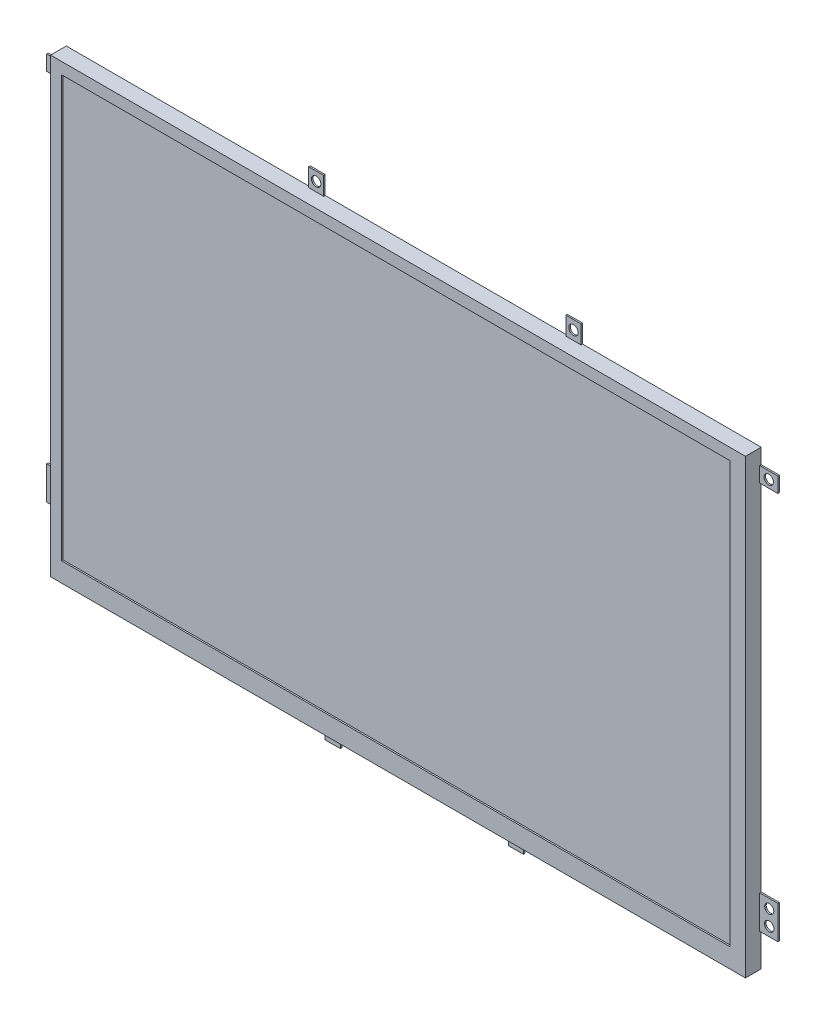
from build123d import *

# Parameters (mm, degrees)
SKETCH1_W                  = 229.46
SKETCH1_H                  = 149.2
BOSS_EXTRUDE1_DEPTH        = 5.2
SKETCH2_W                  = 220.76
SKETCH2_H                  = 139
CUT_EXTRUDE1_DEPTH         = 0.5
SKETCH3_W                  = 6
SKETCH3_H                  = 5
SKETCH3_H_2                = 11
SKETCH3_W_2                = 5
SKETCH3_H_3                = 6
BOSS_EXTRUDE2_DEPTH        = 0.5
SKETCH4_W                  = 5
SKETCH4_H                  = 6
BOSS_EXTRUDE3_DEPTH        = 0.5
F_3_1_3_1_DIAMETER_HOLE1_D = 3.1
F_3_1_3_1_DIAMETER_HOLE4_D = 3.1
F_2_5_2_5_DIAMETER_HOLE2_D = 2.5
F_3_0_3_DIAMETER_HOLE1_D   = 3


with BuildPart() as part:
    # Sketch1 → Boss-Extrude1 (new body)
    with BuildSketch(Plane.XY):
        with Locations((114.73, 74.6)):
            Rectangle(SKETCH1_W, SKETCH1_H)
    extrude(amount=BOSS_EXTRUDE1_DEPTH)

    # Sketch2 → Cut-Extrude1 (cut)
    with BuildSketch(Plane.XY.offset(5.2)):
        with Locations((113.98, 75.9)):
            Rectangle(SKETCH2_W, SKETCH2_H)
    extrude(amount=-CUT_EXTRUDE1_DEPTH, mode=Mode.SUBTRACT)

    # Sketch3 → Boss-Extrude2 (add)
    with BuildSketch(Plane(origin=(0, 0, 0), x_dir=(-1, 0, 0), z_dir=(0, 0, -1))):
        with Locations((-232.46, 141.7)):
            Rectangle(SKETCH3_W, SKETCH3_H)
        with Locations((-232.46, 16.5)):
            Rectangle(SKETCH3_W, SKETCH3_H_2)
        with Locations((-148.96, -3)):
            Rectangle(SKETCH3_W_2, SKETCH3_H_3)
        with Locations((-88.5, -3)):
            Rectangle(SKETCH3_W_2, SKETCH3_H_3)
        with Locations((3, 21.5)):
            Rectangle(SKETCH3_W, SKETCH3_H_2)
        with Locations((3, 141.7)):
            Rectangle(SKETCH3_W, SKETCH3_H)
    extrude(amount=-BOSS_EXTRUDE2_DEPTH)

    # Sketch4 → Boss-Extrude3 (add)
    with BuildSketch(Plane(origin=(0, 0, 0), x_dir=(-1, 0, 0), z_dir=(0, 0, -1))):
        with Locations((-167.96, 152.2)):
            Rectangle(SKETCH4_W, SKETCH4_H)
        with Locations((-83, 152.2)):
            Rectangle(SKETCH4_W, SKETCH4_H)
    extrude(amount=-BOSS_EXTRUDE3_DEPTH)

    # Ø3.1 (3.1) Diameter Hole1 (through all)
    with Locations(Plane.XY.offset(0.5)):
        with Locations((-3, 141.7), (83, 152.2), (167.96, 152.2), (232.46, 141.7), (148.96, -3), (88.5, -3)):
            Hole(F_3_1_3_1_DIAMETER_HOLE1_D / 2)

    # Ø3.1 (3.1) Diameter Hole4 (through all)
    with Locations(Plane.XY.offset(0.5)):
        with Locations((232.618638534, 14)):
            Hole(F_3_1_3_1_DIAMETER_HOLE4_D / 2)

    # Ø2.5 (2.5) Diameter Hole2 (through all)
    with Locations(Plane.XY.offset(0.5)):
        with Locations((-3, 24), (-2.932911523, 19)):
            Hole(F_2_5_2_5_DIAMETER_HOLE2_D / 2)

    # Ø3.0 (3) Diameter Hole1 (through all)
    with Locations(Plane.XY.offset(0.5)):
        with Locations((232.618638534, 19)):
            Hole(F_3_0_3_DIAMETER_HOLE1_D / 2)


solid = part.part
